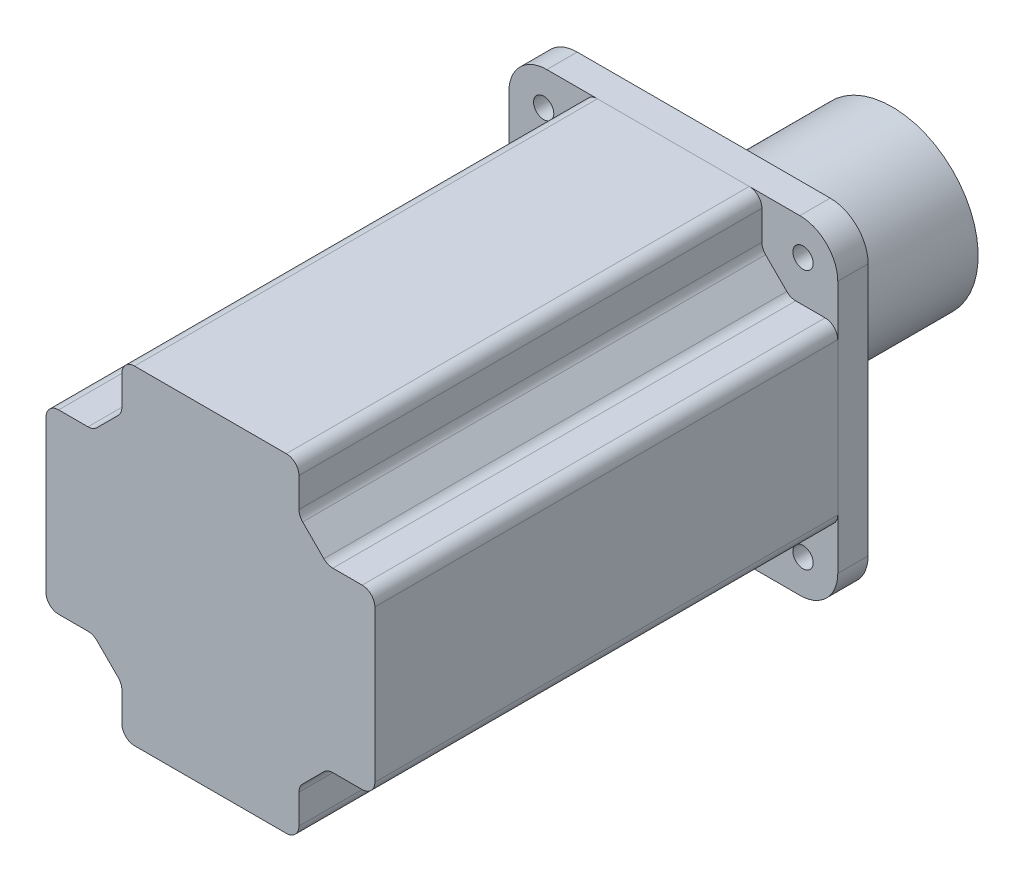
from build123d import *

# Parameters (mm, degrees)
BOSS_EXTRUDE1_DEPTH = 12
BOSS_EXTRUDE2_DEPTH = 183
FILLET1_R           = 5
SKETCH4_R           = 55
BOSS_EXTRUDE4_DEPTH = 8
CHAMFER1_SIZE       = 6
CHAMFER1_SIZE2      = 16.484864517
SKETCH3_R           = 34
BOSS_EXTRUDE3_DEPTH = 66.5


with BuildPart() as part:
    # Sketch1 → Boss-Extrude1 (new body)
    with BuildSketch(Plane.XY):
        with BuildLine():
            Line((32.113081447, 65), (-32.113081447, 65))
            ThreePointArc((-32.113081447, 65), (-40.60965067, 60.059189742), (-48.359865355, 54.014566765))
            ThreePointArc((-48.359865355, 54.014566765), (-47.548959547, 52.744852206), (-47.265241636, 51.265241636))
            ThreePointArc((-47.265241636, 51.265241636), (-49.683676038, 47.591190703), (-54.014566765, 48.359865355))
            ThreePointArc((-54.014566765, 48.359865355), (-60.059189742, 40.60965067), (-65, 32.113081447))
            Line((-65, 32.113081447), (-65, -32.113081447))
            ThreePointArc((-65, -32.113081447), (-60.059189742, -40.60965067), (-54.014566765, -48.359865355))
            ThreePointArc((-54.014566765, -48.359865355), (-49.683676038, -47.591190703), (-47.265241636, -51.265241636))
            ThreePointArc((-47.265241636, -51.265241636), (-47.548959547, -52.744852206), (-48.359865355, -54.014566765))
            ThreePointArc((-48.359865355, -54.014566765), (-40.60965067, -60.059189742), (-32.113081447, -65))
            Line((-32.113081447, -65), (32.113081447, -65))
            ThreePointArc((32.113081447, -65), (40.60965067, -60.059189742), (48.359865355, -54.014566765))
            ThreePointArc((48.359865355, -54.014566765), (48.436814511, -48.436814511), (54.014566765, -48.359865355))
            ThreePointArc((54.014566765, -48.359865355), (60.059189742, -40.60965067), (65, -32.113081447))
            Line((65, -32.113081447), (65, 32.113081447))
            ThreePointArc((65, 32.113081447), (60.059189742, 40.60965067), (54.014566765, 48.359865355))
            ThreePointArc((54.014566765, 48.359865355), (48.436814511, 48.436814511), (48.359865355, 54.014566765))
            ThreePointArc((48.359865355, 54.014566765), (40.60965067, 60.059189742), (32.113081447, 65))
        make_face()
        with BuildLine():
            Line((-32.113081447, 65), (-50, 65))
            ThreePointArc((-50, 65), (-60.606601718, 60.606601718), (-65, 50))
            Line((-65, 50), (-65, 32.113081447))
            ThreePointArc((-65, 32.113081447), (-60.059189742, 40.60965067), (-54.014566765, 48.359865355))
            ThreePointArc((-54.014566765, 48.359865355), (-54.093668761, 54.093668761), (-48.359865355, 54.014566765))
            ThreePointArc((-48.359865355, 54.014566765), (-40.60965067, 60.059189742), (-32.113081447, 65))
        make_face()
        with BuildLine():
            ThreePointArc((-54.014566765, -48.359865355), (-60.059189742, -40.60965067), (-65, -32.113081447))
            Line((-65, -32.113081447), (-65, -50))
            ThreePointArc((-65, -50), (-60.606601718, -60.606601718), (-50, -65))
            Line((-50, -65), (-32.113081447, -65))
            ThreePointArc((-32.113081447, -65), (-40.60965067, -60.059189742), (-48.359865355, -54.014566765))
            ThreePointArc((-48.359865355, -54.014566765), (-54.093668761, -54.093668761), (-54.014566765, -48.359865355))
        make_face()
        with BuildLine():
            Line((65, -50), (65, -32.113081447))
            ThreePointArc((65, -32.113081447), (60.059189742, -40.60965067), (54.014566765, -48.359865355))
            ThreePointArc((54.014566765, -48.359865355), (54.939292569, -49.683676038), (55.265241636, -51.265241636))
            ThreePointArc((55.265241636, -51.265241636), (52.744852206, -54.981523725), (48.359865355, -54.014566765))
            ThreePointArc((48.359865355, -54.014566765), (40.60965067, -60.059189742), (32.113081447, -65))
            Line((32.113081447, -65), (50, -65))
            ThreePointArc((50, -65), (60.606601718, -60.606601718), (65, -50))
        make_face()
        with BuildLine():
            Line((50, 65), (32.113081447, 65))
            ThreePointArc((32.113081447, 65), (40.60965067, 60.059189742), (48.359865355, 54.014566765))
            ThreePointArc((48.359865355, 54.014566765), (52.744852206, 54.981523725), (55.265241636, 51.265241636))
            ThreePointArc((55.265241636, 51.265241636), (54.939292569, 49.683676038), (54.014566765, 48.359865355))
            ThreePointArc((54.014566765, 48.359865355), (60.059189742, 40.60965067), (65, 32.113081447))
            Line((65, 32.113081447), (65, 50))
            ThreePointArc((65, 50), (60.606601718, 60.606601718), (50, 65))
        make_face()
    extrude(amount=BOSS_EXTRUDE1_DEPTH)

    # Sketch4 → Boss-Extrude4 (add)
    with BuildSketch(Plane(origin=(0, 0, 0), x_dir=(-1, 0, 0), z_dir=(0, 0, -1))):
        with Locations(Location((0, 0, 0), (0, 0, 180))):
            Circle(SKETCH4_R)
    extrude(amount=BOSS_EXTRUDE4_DEPTH)

    # Chamfer1
    chamfer1_edges = [part.edges().sort_by_distance(p)[0] for p in [
        (-55, 0, -8),
    ]]
    chamfer1_side = [part.faces().sort_by_distance(p)[0] for p in [
        (-55, 0, -4),
    ]]
    chamfer(chamfer1_edges, length=CHAMFER1_SIZE, length2=CHAMFER1_SIZE2, reference=chamfer1_side[0])

    # Sketch3 → Boss-Extrude3 (add)
    with BuildSketch(Plane(origin=(0, 0, -8), x_dir=(-1, 0, 0), z_dir=(0, 0, -1))):
        Circle(SKETCH3_R)
    extrude(amount=BOSS_EXTRUDE3_DEPTH)


with BuildPart() as body_2:
    # Sketch2 → Boss-Extrude2 (new body)
    with BuildSketch(Plane.XY.offset(12)):
        Polygon((-46.313708499, 35), (-65, 35), (-65, -35), (-46.313708499, -35), (-35, -46.313708499), (-35, -65), (35, -65), (35, -46.313708499), (46.313708499, -35), (65, -35), (65, 35), (46.313708499, 35), (35, 46.313708499), (35, 65), (-35, 65), (-35, 46.313708499), align=None)
    extrude(amount=BOSS_EXTRUDE2_DEPTH)

    # Fillet1
    fillet1_edges = [body_2.edges().sort_by_distance(p)[0] for p in [
        (-65, 35, 103.5),
        (-46.313708499, 35, 103.5),
        (-35, 46.313708499, 103.5),
        (-35, 65, 103.5),
        (35, 65, 103.5),
        (35, 46.313708499, 103.5),
        (46.313708499, 35, 103.5),
        (65, 35, 103.5),
        (65, -35, 103.5),
        (46.313708499, -35, 103.5),
        (35, -46.313708499, 103.5),
        (35, -65, 103.5),
        (-35, -65, 103.5),
        (-35, -46.313708499, 103.5),
        (-46.313708499, -35, 103.5),
        (-65, -35, 103.5),
    ]]
    fillet(fillet1_edges, radius=FILLET1_R)


solid = Compound([part.part, body_2.part])
